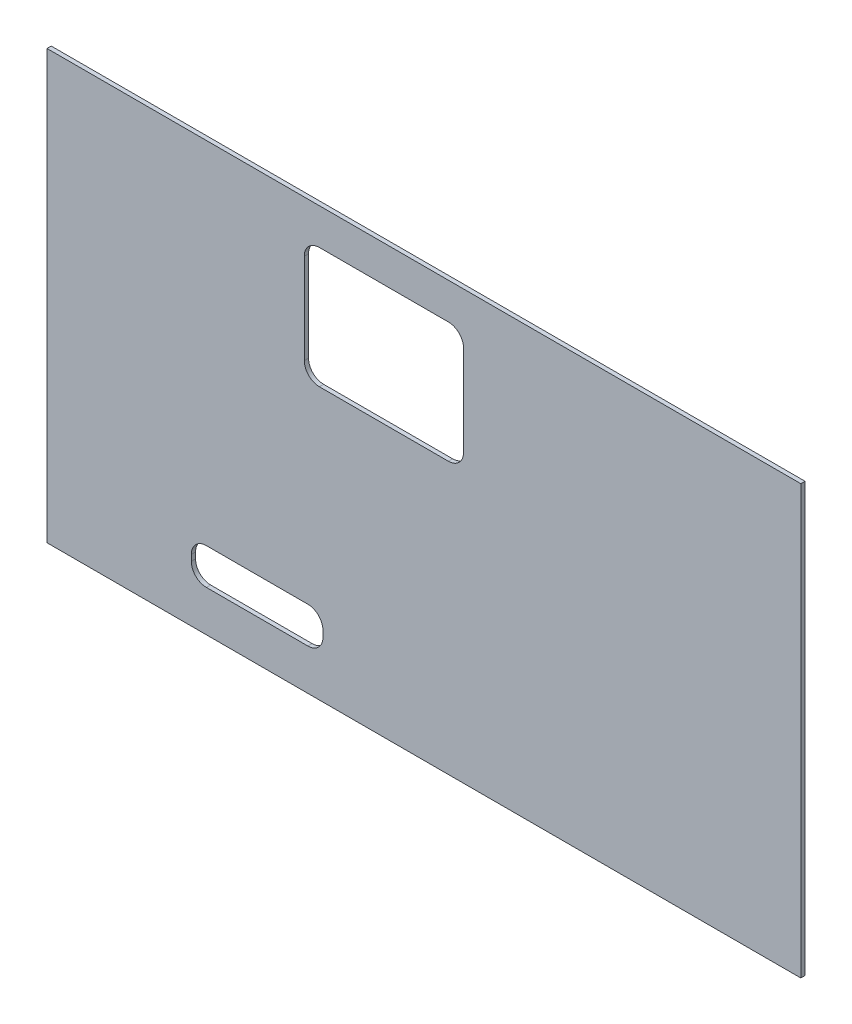
from build123d import *

# Parameters (mm, degrees)
SKETCH2_W           = 21.826709
SKETCH2_H           = 6
SKETCH2_W_2         = 26.410128
SKETCH2_H_2         = 20
BOSS_EXTRUDE5_DEPTH = 0.7
BOSS_EXTRUDE6_DEPTH = 5
FILLET1_R           = 2.5


with BuildPart() as part:
    # Sketch2 → Boss-Extrude5 (new body)
    with BuildSketch(Plane.XY):
        Polygon((0, 0), (0, -71), (16.75, -71), (125.022768, -71), (125.022768, 0), align=None)
        with Locations((34.8557935, -61.193169)):
            Rectangle(SKETCH2_W, SKETCH2_H, mode=Mode.SUBTRACT)
        with Locations((55.882521, -16)):
            Rectangle(SKETCH2_W_2, SKETCH2_H_2, mode=Mode.SUBTRACT)
    extrude(amount=BOSS_EXTRUDE5_DEPTH)

    # Sketch2<9> → Boss-Extrude6 (add)
    with BuildSketch(Plane.XY):
        Polygon((113.138624, -23.45), (113.138624, -33.15), (119.888624, -16.95), (119.888624, -7.25), align=None)
        Polygon((100.388624, -7.25), (100.388624, -16.95), (107.138624, -33.15), (107.138624, -23.45), align=None)
        Polygon((114.763624, -6.25), (105.513624, -6.25), (110.138624, -17.35), align=None)
        Polygon((18.625, -6.25), (9.375, -6.25), (14, -17.35), align=None)
        Polygon((11, -23.45), (4.25, -7.25), (4.25, -16.95), (11, -33.15), align=None)
        Polygon((23.75, -16.95), (23.75, -7.25), (17, -23.45), (17, -33.15), align=None)
    extrude(amount=-BOSS_EXTRUDE6_DEPTH)

    # Fillet1
    fillet1_edges = [part.edges().sort_by_distance(p)[0] for p in [
        (23.942439, -64.193169, 0.35),
        (45.769148, -64.193169, 0.35),
        (45.769148, -58.193169, 0.35),
        (23.942439, -58.193169, 0.35),
        (42.677457, -6, 0.35),
        (69.087585, -6, 0.35),
        (42.677457, -26, 0.35),
        (69.087585, -26, 0.35),
    ]]
    fillet(fillet1_edges, radius=FILLET1_R)


solid = part.part
